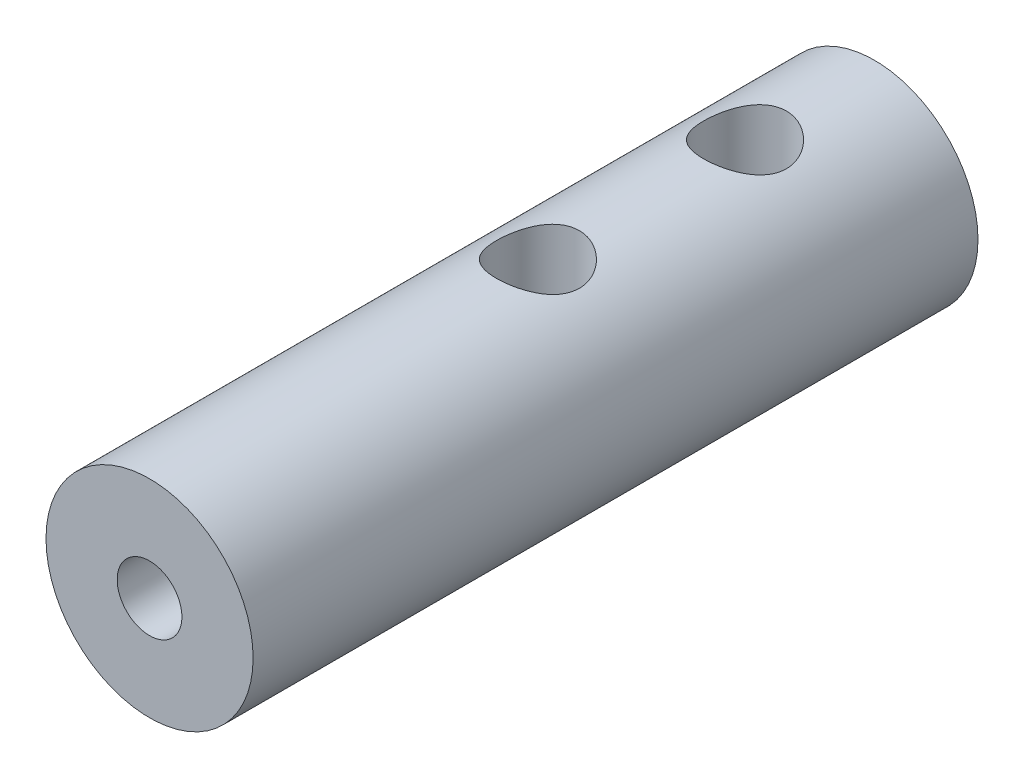
from build123d import *

# Parameters (mm, degrees)
SKETCH_311_R          = 4
EXTRUDE_356_DEPTH     = 28
SKETCH_440_R          = 1.6
CUT_EXTRUDE_537_DEPTH = 30.393876913
SKETCH_1_R            = 1.25
CUT_EXTRUDE_1_DEPTH   = 8


with BuildPart() as part:
    # Sketch 311 → Extrude 356 (new body)
    with BuildSketch(Plane.XY):
        Circle(SKETCH_311_R)
    extrude(amount=EXTRUDE_356_DEPTH)

    # Sketch 440 → Cut-Extrude 537 (cut, through all)
    with BuildSketch(Plane(origin=(0, 4, 0), x_dir=(1, 0, 0), z_dir=(0, 1, 0))):
        with Locations((0, -5)):
            Circle(SKETCH_440_R)
        with Locations((0, -13)):
            Circle(SKETCH_440_R)
    extrude(amount=-CUT_EXTRUDE_537_DEPTH, mode=Mode.SUBTRACT)

    # ｽｹｯﾁ1 → ｶｯﾄ - 押し出し1 (cut)
    with BuildSketch(Plane.XY.offset(28)):
        Circle(SKETCH_1_R)
    extrude(amount=-CUT_EXTRUDE_1_DEPTH, mode=Mode.SUBTRACT)


solid = part.part
